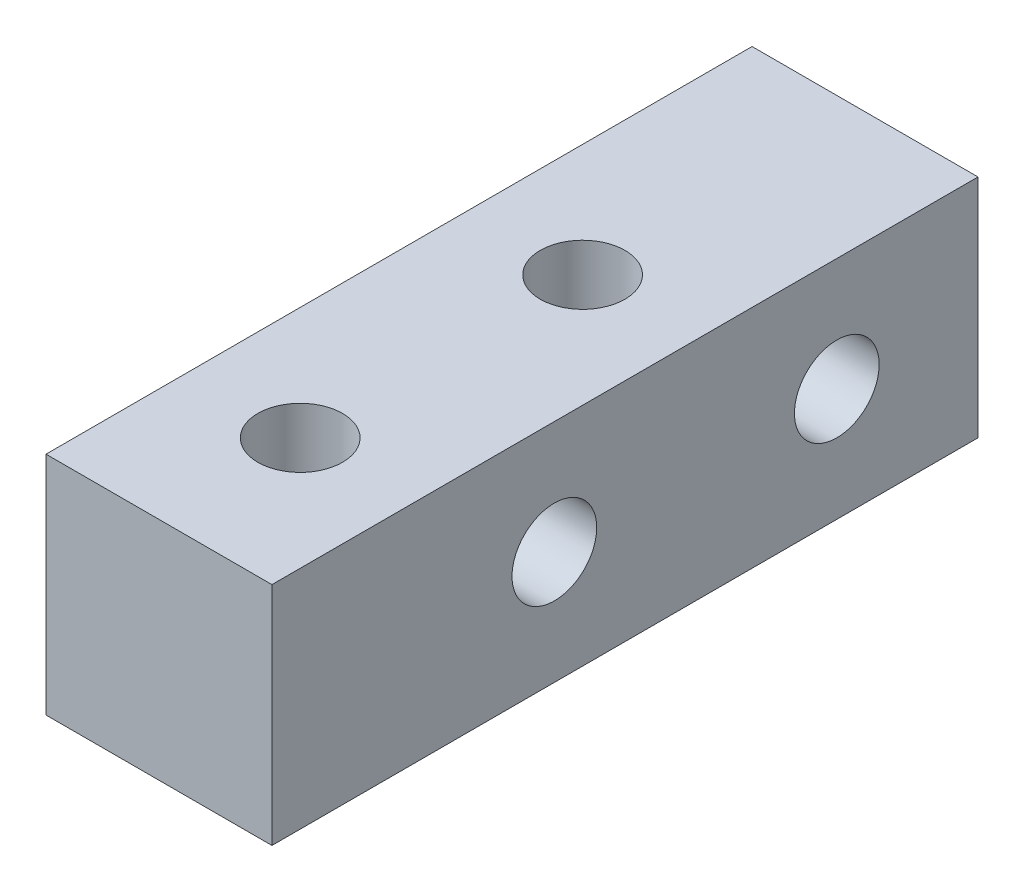
from build123d import *

# Parameters (mm, degrees)
SKETCH_1_W          = 8
SKETCH_1_H          = 8
EXTRUDE_1_DEPTH     = 25
SKETCH_2_R          = 1.5
CUT_EXTRUDE_1_DEPTH = 8
SKETCH_3_R          = 1.5
CUT_EXTRUDE_2_DEPTH = 8


with BuildPart() as part:
    # 草图1 → 凸台-拉伸1 (new body)
    with BuildSketch(Plane.XY):
        Rectangle(SKETCH_1_W, SKETCH_1_H)
    extrude(amount=EXTRUDE_1_DEPTH)

    # 草图2 → 切除-拉伸1 (cut)
    with BuildSketch(Plane(origin=(4, 0, 0), x_dir=(0, 0, -1), z_dir=(1, 0, 0))):
        with Locations((-5, 0)):
            Circle(SKETCH_2_R)
        with Locations((-15, 0)):
            Circle(SKETCH_2_R)
    extrude(amount=-CUT_EXTRUDE_1_DEPTH, mode=Mode.SUBTRACT)

    # 草图3 → 切除-拉伸2 (cut)
    with BuildSketch(Plane(origin=(0, 4, 0), x_dir=(1, 0, 0), z_dir=(0, 1, 0))):
        with Locations(Location((0, -10, 0), (0, 0, 270))):
            Circle(SKETCH_3_R)
        with Locations(Location((0, -20, 0), (0, 0, 270))):
            Circle(SKETCH_3_R)
    extrude(amount=-CUT_EXTRUDE_2_DEPTH, mode=Mode.SUBTRACT)


solid = part.part
